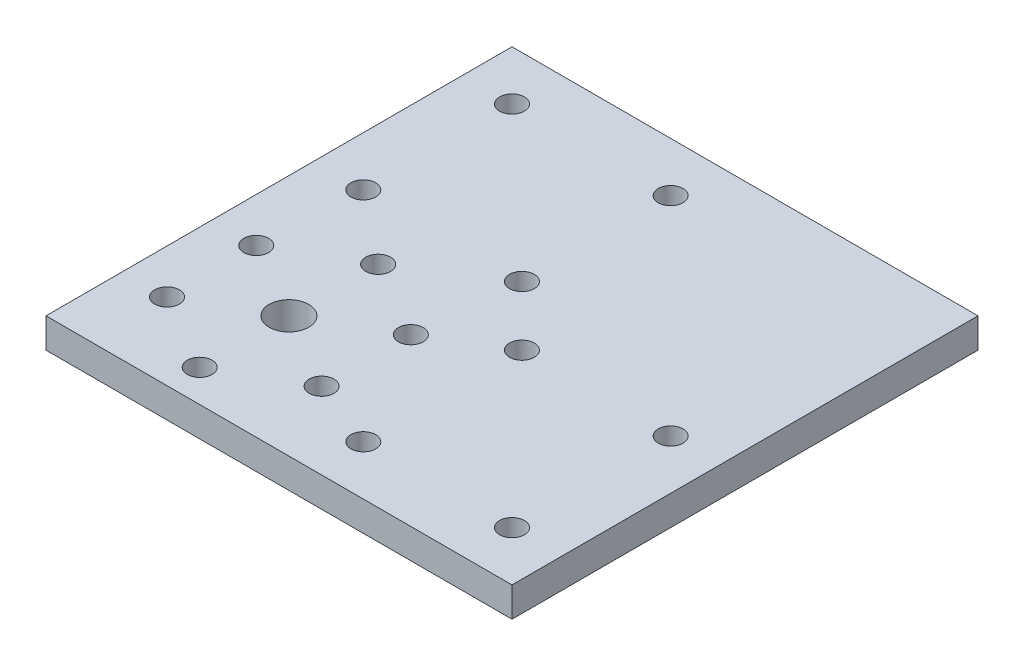
from build123d import *

# Parameters (mm, degrees)
SKETCH1_W                   = 47
SKETCH1_H                   = 47
BOSS_EXTRUDE1_DEPTH         = 3
TAP_DRILL_FOR_M3X0_5_TAP1_D = 2.5
TAP_DRILL_FOR_M3X0_5_TAP2_D = 2.5
F_4_0_4_DIAMETER_HOLE1_D    = 4


with BuildPart() as part:
    # Sketch1 → Boss-Extrude1 (new body)
    with BuildSketch(Plane(origin=(0, 0, 0), x_dir=(1, 0, 0), z_dir=(0, 1, 0))):
        with Locations((10.5, -11)):
            Rectangle(SKETCH1_W, SKETCH1_H)
    extrude(amount=BOSS_EXTRUDE1_DEPTH)

    # Tap Drill for M3x0.5 Tap1 (through all)
    with Locations(Plane(origin=(0, 3, 0), x_dir=(1, 0, 0), z_dir=(0, 1, 0))):
        with Locations((-8, 7.5), (8, 7.5), (8, -7.5), (-8, -7.5), (14, -13.5), (29, -13.5), (29, -29.5), (14, -29.5)):
            Hole(TAP_DRILL_FOR_M3X0_5_TAP1_D / 2)

    # Tap Drill for M3x0.5 Tap2 (through all)
    with Locations(Plane(origin=(0, 3, 0), x_dir=(1, 0, 0), z_dir=(0, 1, 0))):
        with Locations((-0.75, -13.25), (-8.544228634, -17.75), (-8.544228634, -26.75), (-0.75, -31.25), (7.044228634, -26.75), (7.044228634, -17.75)):
            Hole(TAP_DRILL_FOR_M3X0_5_TAP2_D / 2)

    # Ø4.0 (4) Diameter Hole1 (through all)
    with Locations(Plane(origin=(0, 3, 0), x_dir=(1, 0, 0), z_dir=(0, 1, 0))):
        with Locations((-0.75, -22.25)):
            Hole(F_4_0_4_DIAMETER_HOLE1_D / 2)


solid = part.part
